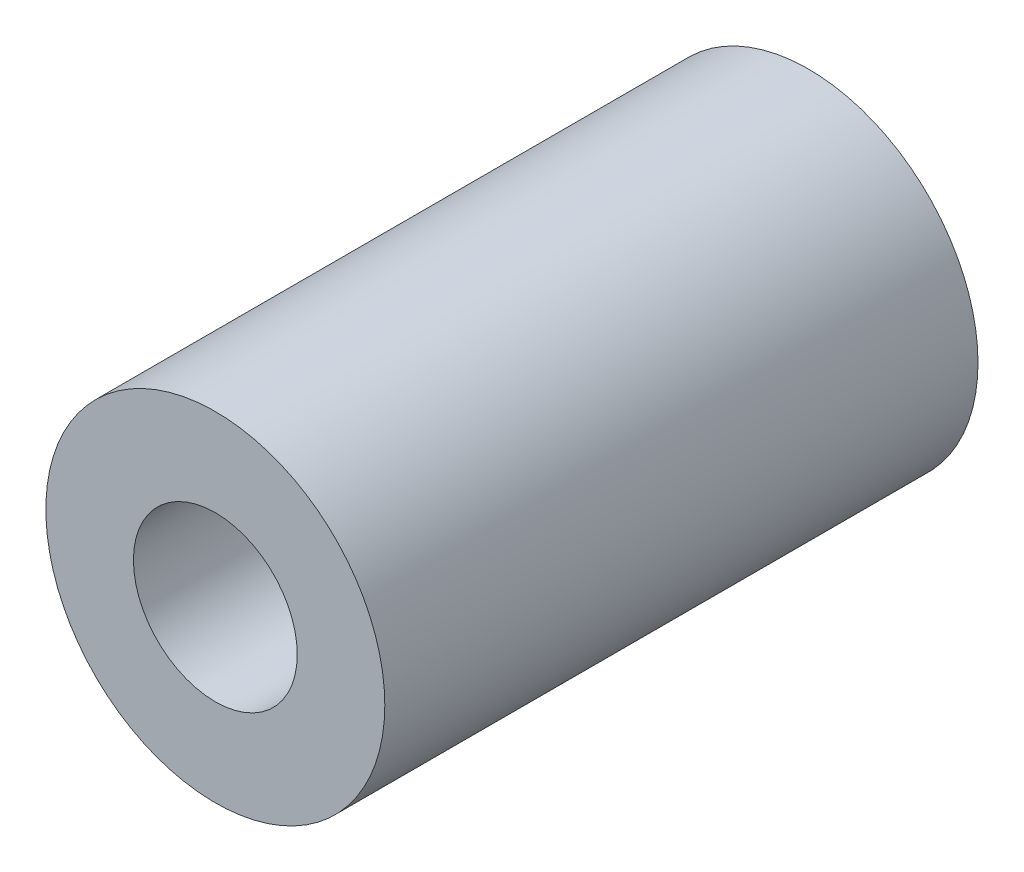
from build123d import *

# Parameters (mm, degrees)
SKETCH_1_R      = 30
SKETCH_1_R_2    = 14.5
EXTRUDE_1_DEPTH = 52.5


with BuildPart() as part:
    # 草图1 → 凸台-拉伸1 (new, symmetric)
    with BuildSketch(Plane.XY):
        Circle(SKETCH_1_R)
        Circle(SKETCH_1_R_2, mode=Mode.SUBTRACT)
    extrude(amount=EXTRUDE_1_DEPTH, both=True)


solid = part.part
